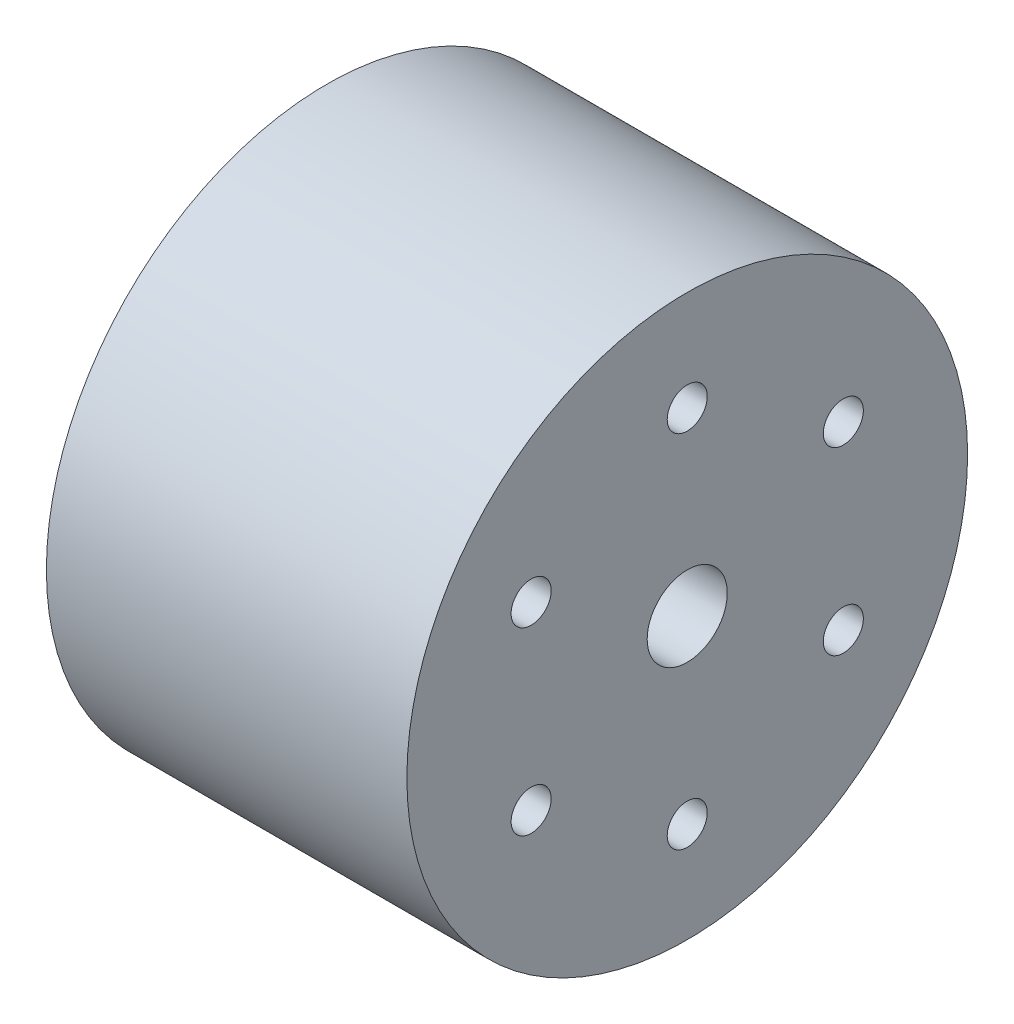
from build123d import *

# Parameters (mm, degrees)
SKETCH2_R          = 2.5
CUT_EXTRUDE1_DEPTH = 45


with BuildPart() as part:
    # Sketch1 → Revolve1 (revolve)
    with BuildSketch(Plane.XY, mode=Mode.PRIVATE) as revolve1_sk:
        Polygon((14.45, 35), (14.45, 16), (19.45, 16), (19.45, 5), (59.45, 5), (59.45, 35), align=None)
    revolve(revolve1_sk.sketch.rotate(Axis((0, 0, 0), (1, 0, 0)), 90), axis=Axis((0, 0, 0), (1, 0, 0)))

    # Sketch2 → Cut-Extrude1 (cut)
    with BuildSketch(Plane.ZY.offset(-14.45)):
        with Locations((19.485571585, 11.25)):
            Circle(SKETCH2_R)
        with Locations((19.485571585, -11.25)):
            Circle(SKETCH2_R)
        with Locations((0, -22.5)):
            Circle(SKETCH2_R)
        with Locations((-19.485571585, -11.25)):
            Circle(SKETCH2_R)
        with Locations((-19.485571585, 11.25)):
            Circle(SKETCH2_R)
        with Locations((0, 22.5)):
            Circle(SKETCH2_R)
    extrude(amount=-CUT_EXTRUDE1_DEPTH, mode=Mode.SUBTRACT)


solid = part.part
